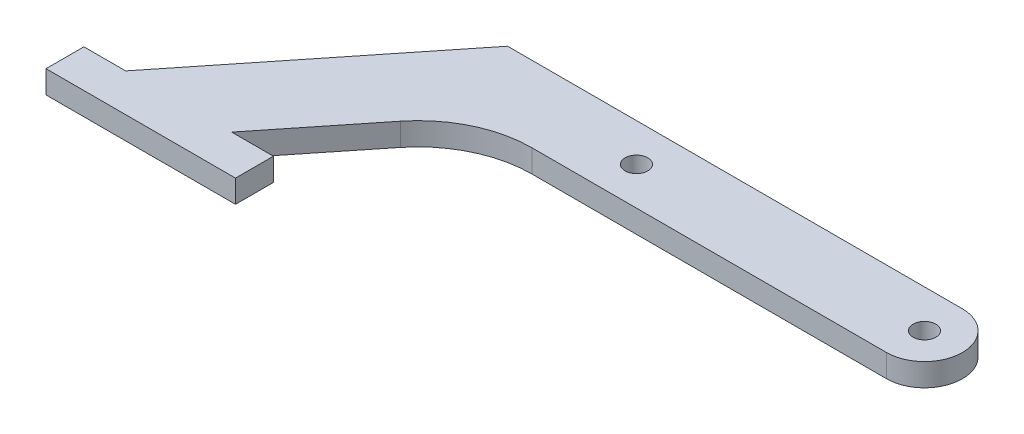
from build123d import *

# Parameters (mm, degrees)
SKETCH_1_R      = 1.5
EXTRUDE_1_DEPTH = 3
FILLET_5_R      = 15


with BuildPart() as part:
    # 草图1 → 凸台-拉伸1 (new body)
    with BuildSketch(Plane(origin=(0, 0, 0), x_dir=(1, 0, 0), z_dir=(0, 1, 0))):
        with BuildLine():
            Line((0, 5), (-60, 5))
            Line((-60, 5), (-82.371742522, -23.015711498))
            Line((-82.371742522, -23.015711498), (-87.879028911, -23.015711498))
            Line((-87.879028911, -23.015711498), (-87.879028911, -28.015711498))
            Line((-87.879028911, -28.015711498), (-62.879028911, -28.015711498))
            Line((-62.879028911, -28.015711498), (-62.879028911, -23.015711498))
            Line((-62.879028911, -23.015711498), (-68.3863153, -23.015711498))
            Line((-68.3863153, -23.015711498), (-54, -5))
            Line((-54, -5), (0, -5))
            ThreePointArc((0, -5), (5, 0), (0, 5))
        make_face()
        with Locations(Location((0, 0, 0), (0, 0, 270))):
            Circle(SKETCH_1_R, mode=Mode.SUBTRACT)
        with Locations(Location((-38, 0, 0), (0, 0, 270))):
            Circle(SKETCH_1_R, mode=Mode.SUBTRACT)
    extrude(amount=EXTRUDE_1_DEPTH)

    # 圆角5
    fillet_5_edges = [part.edges().sort_by_distance(p)[0] for p in [
        (-54, 1.5, 5),
    ]]
    fillet(fillet_5_edges, radius=FILLET_5_R)


solid = part.part
